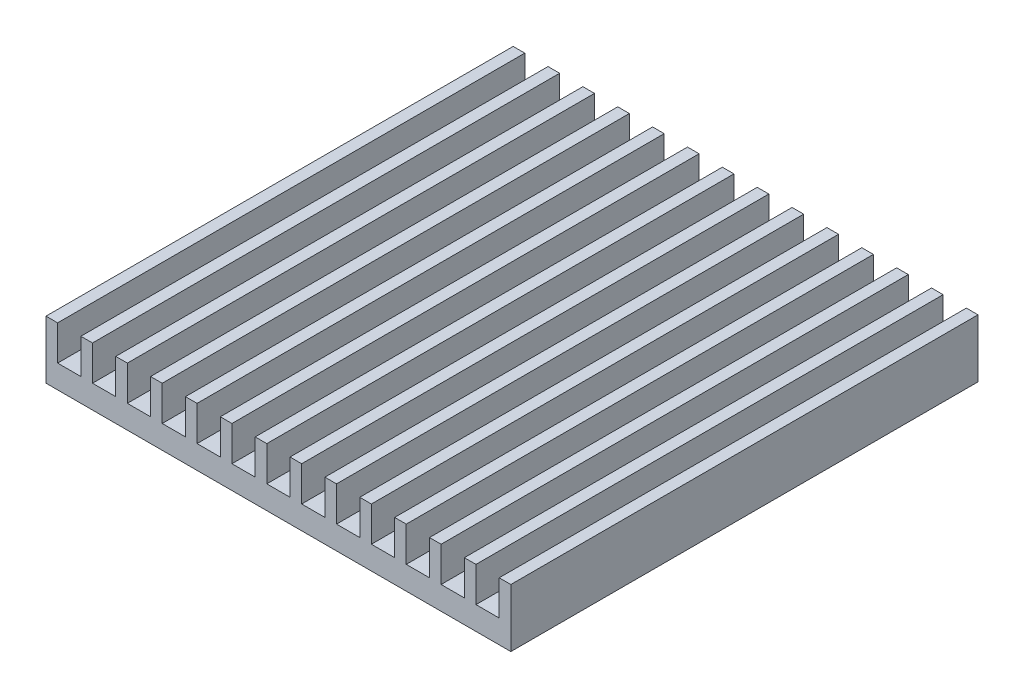
from build123d import *

# Parameters (mm, degrees)
SKETCH_1_W      = 40
SKETCH_1_H      = 40.2
EXTRUDE_1_DEPTH = 2
SKETCH_2_W      = 1
SKETCH_2_H      = 40.2
EXTRUDE_2_DEPTH = 3


with BuildPart() as part:
    # 草图1 → 凸台-拉伸1 (new body)
    with BuildSketch(Plane(origin=(0, 0, 0), x_dir=(1, 0, 0), z_dir=(0, 1, 0))):
        Rectangle(SKETCH_1_W, SKETCH_1_H)
    extrude(amount=EXTRUDE_1_DEPTH)

    # 草图2 → 凸台-拉伸2 (add)
    with BuildSketch(Plane(origin=(0, 2, 0), x_dir=(1, 0, 0), z_dir=(0, 1, 0))):
        with Locations((-19.5, 0)):
            Rectangle(SKETCH_2_W, SKETCH_2_H)
        with Locations((-16.5, 0)):
            Rectangle(SKETCH_2_W, SKETCH_2_H)
        with Locations((-13.5, 0)):
            Rectangle(SKETCH_2_W, SKETCH_2_H)
        with Locations((-10.5, 0)):
            Rectangle(SKETCH_2_W, SKETCH_2_H)
        with Locations((-7.5, 0)):
            Rectangle(SKETCH_2_W, SKETCH_2_H)
        with Locations((-4.5, 0)):
            Rectangle(SKETCH_2_W, SKETCH_2_H)
        with Locations((-1.5, 0)):
            Rectangle(SKETCH_2_W, SKETCH_2_H)
        with Locations((1.5, 0)):
            Rectangle(SKETCH_2_W, SKETCH_2_H)
        with Locations((4.5, 0)):
            Rectangle(SKETCH_2_W, SKETCH_2_H)
        with Locations((7.5, 0)):
            Rectangle(SKETCH_2_W, SKETCH_2_H)
        with Locations((10.5, 0)):
            Rectangle(SKETCH_2_W, SKETCH_2_H)
        with Locations((13.5, 0)):
            Rectangle(SKETCH_2_W, SKETCH_2_H)
        with Locations((16.5, 0)):
            Rectangle(SKETCH_2_W, SKETCH_2_H)
        with Locations((19.5, 0)):
            Rectangle(SKETCH_2_W, SKETCH_2_H)
    extrude(amount=EXTRUDE_2_DEPTH)


solid = part.part
